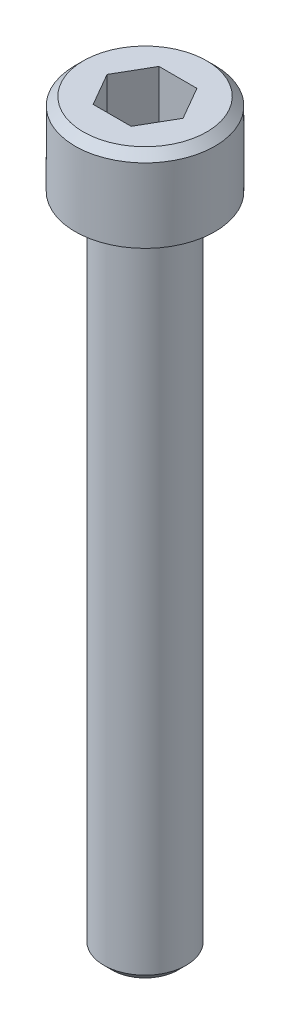
from build123d import *
from build123d.topology import SkipClean

# Parameters (mm, degrees)
CHAMFER1_SIZE      = 0.5
FILLET2_R          = 1
CUT_EXTRUDE1_DEPTH = 4


with BuildPart() as part:
    # Sketch1 → Revolve1 (revolve)
    with BuildSketch(Plane.XY, mode=Mode.PRIVATE) as revolve1_sk:
        Polygon((0, 0), (4.25, 0), (4.25, -5), (2.5, -5), (2.5, -45), (0, -45), align=None)
    revolve(revolve1_sk.sketch.rotate(Axis((0, -45, 0), (0, 1, 0)), 90), axis=Axis((0, -45, 0), (0, 1, 0)))

    # Chamfer1
    chamfer1_edges = [part.edges().sort_by_distance(p)[0] for p in [
        (0, -45, 2.5),
        (0, 0, 4.25),
    ]]
    chamfer(chamfer1_edges, length=CHAMFER1_SIZE)

    # Sketch2 → Cut-Revolve1 (revolve, cut)
    with SkipClean():  # the faces are left unmerged after this step: merging them gives an invalid solid
        with BuildSketch(Plane.XY, mode=Mode.PRIVATE) as cut_revolve1_sk:
            Polygon((3.95, -4.9), (2.5, -4.9), (2.5, -5.679573885), (4.05, -5.679573885), (4.05, -5), align=None)
        revolve(cut_revolve1_sk.sketch.rotate(Axis((0, 0, 0), (0, -1, 0)), 90), axis=Axis((0, 0, 0), (0, -1, 0)), mode=Mode.SUBTRACT)

    # Fillet2
    fillet2_edges = [part.edges().sort_by_distance(p)[0] for p in [
        (0, -4.9, -2.5),
    ]]
    fillet(fillet2_edges, radius=FILLET2_R)

    # Sketch3 → Cut-Extrude1 (cut)
    with BuildSketch(Plane(origin=(0, 0, 0), x_dir=(1, 0, 0), z_dir=(0, 1, 0))):
        Polygon((-1.154700538, 2), (-2.309401077, 0), (-1.154700538, -2), (1.154700538, -2), (2.309401077, 0), (1.154700538, 2), align=None)
    extrude(amount=-CUT_EXTRUDE1_DEPTH, mode=Mode.SUBTRACT)


solid = part.part
